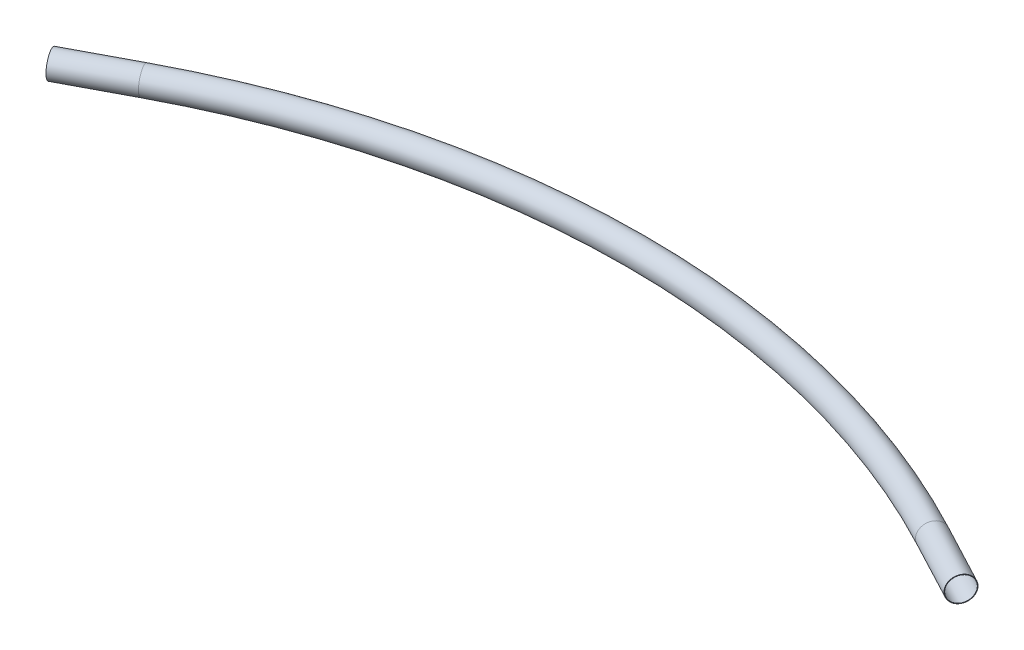
from build123d import *

# Parameters (mm, degrees)
SKETCH12_R                 = 84.1375
SKETCH12_R_2               = 80.7339
STRUCTURAL_MEMBER1_DEPTH   = 457.2
SKETCH12_ON_SEGMENT_2_R    = 84.1375
SKETCH12_ON_SEGMENT_2_R_2  = 80.7339
STRUCTURAL_MEMBER1_2_ANGLE = 55.754985959
SKETCH12_ON_SEGMENT_3_R    = 84.1375
SKETCH12_ON_SEGMENT_3_R_2  = 80.7339
STRUCTURAL_MEMBER1_3_DEPTH = 457.2


with BuildPart() as part:
    # Sketch12 → Structural Member1 (new body)
    with BuildSketch(Plane(origin=(2635.25, 0, 0), x_dir=(-0.46758261592482786, 0, 0.8839493748427536), z_dir=(-0.8839493748427536, 0, -0.46758261592482786))):
        Circle(SKETCH12_R)
        Circle(SKETCH12_R_2, mode=Mode.SUBTRACT)
    extrude(amount=-STRUCTURAL_MEMBER1_DEPTH)


with BuildPart() as body_2:
    # Sketch12 on segment 2 (carried to the start of arc 2) → Structural Member1 2 (revolve)
    with BuildSketch(Plane(origin=(2635.25, 0, 0), x_dir=(0.467582616, 0, -0.883949375), z_dir=(0.883949375, 0, 0.467582616))):
        Circle(SKETCH12_ON_SEGMENT_2_R)
        Circle(SKETCH12_ON_SEGMENT_2_R_2, mode=Mode.SUBTRACT)
    revolve(axis=Axis((0, 0, 4981.852427184), (0, 1, 0)), revolution_arc=STRUCTURAL_MEMBER1_2_ANGLE)


with BuildPart() as body_3:
    # Sketch12 on segment 3 (carried to segment 3) → Structural Member1 3 (new body)
    with BuildSketch(Plane(origin=(-3039.391654178, 0, 213.778772001), x_dir=(-0.467582616, 0, -0.883949375), z_dir=(0.883949375, 0, -0.467582616))):
        Circle(SKETCH12_ON_SEGMENT_3_R)
        Circle(SKETCH12_ON_SEGMENT_3_R_2, mode=Mode.SUBTRACT)
    extrude(amount=STRUCTURAL_MEMBER1_3_DEPTH)


solid = Compound([part.part, body_2.part, body_3.part])
